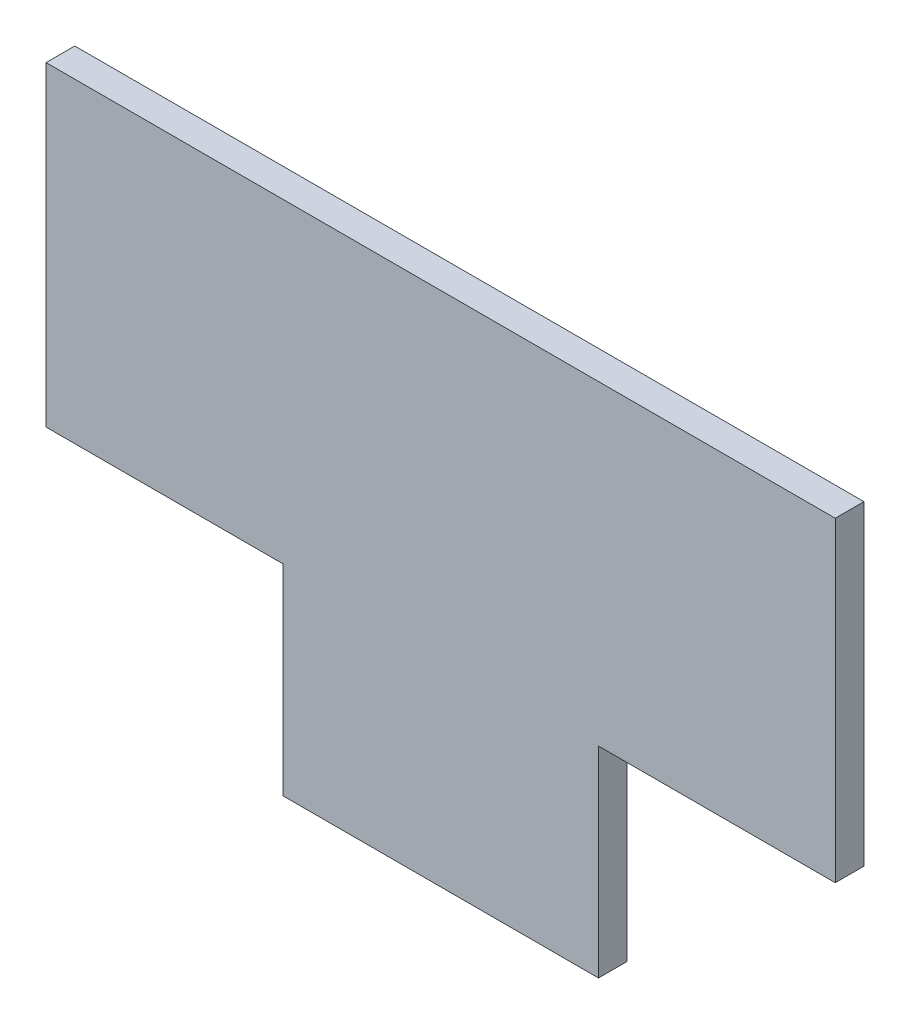
from build123d import *

# Parameters (mm, degrees)
SALIENTE_EXTRUIR1_DEPTH = 1


with BuildPart() as part:
    # Croquis1 → Saliente-Extruir1 (new body)
    with BuildSketch(Plane.XY):
        Polygon((-5.5, 0), (5.5, 0), (5.5, 7), (13.75, 7), (13.75, 18), (-13.75, 18), (-13.75, 7), (-5.5, 7), align=None)
    extrude(amount=SALIENTE_EXTRUIR1_DEPTH)


solid = part.part
